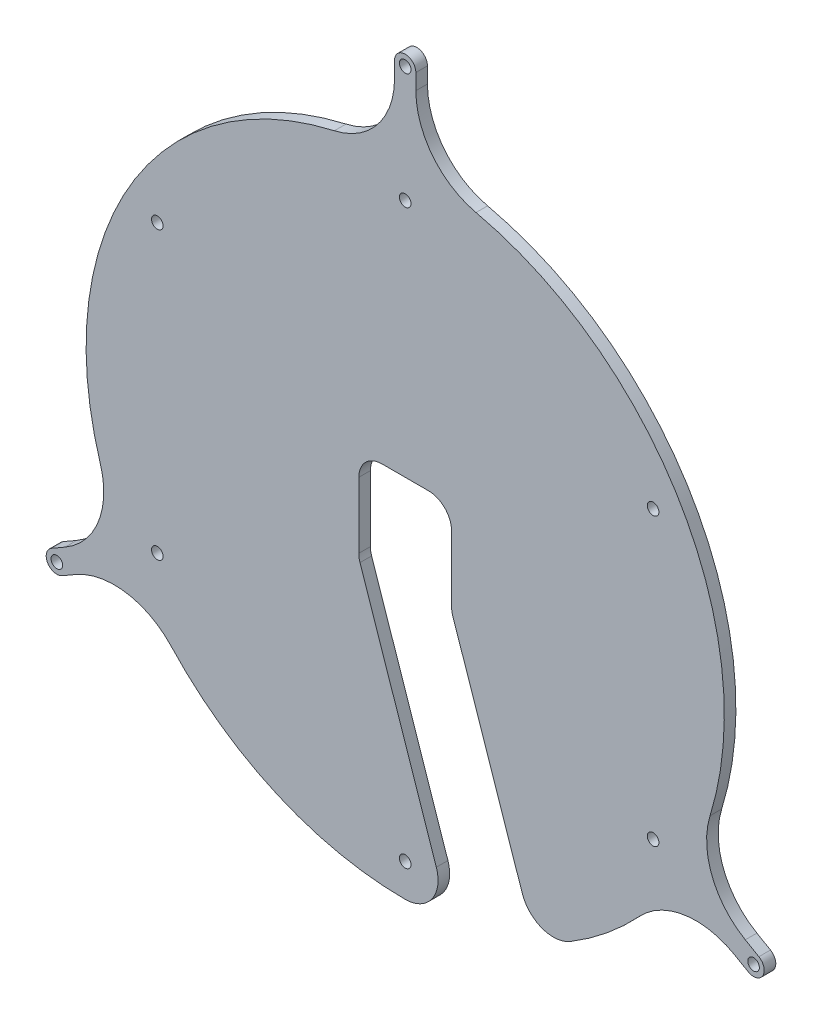
from build123d import *

# Parameters (mm, degrees)
SKETCH1_R           = 82.5
SKETCH1_R_2         = 1.5
BOSS_EXTRUDE1_DEPTH = 3
CUT_EXTRUDE1_DEPTH  = 117.711181984
FILLET1_R           = 6
BOSS_EXTRUDE2_START = -3
SKETCH3_R           = 1.5
BOSS_EXTRUDE2_DEPTH = 3
CIRPATTERN1_COUNT   = 3


with BuildPart() as part:
    # Sketch1 → Boss-Extrude1 (new body)
    with BuildSketch(Plane.XY):
        Circle(SKETCH1_R)
        with Locations((0, 74)):
            Circle(SKETCH1_R_2, mode=Mode.SUBTRACT)
        with Locations((0, -74)):
            Circle(SKETCH1_R_2, mode=Mode.SUBTRACT)
        with Locations((64.08587988, 37)):
            Circle(SKETCH1_R_2, mode=Mode.SUBTRACT)
        with Locations((64.08587988, -37)):
            Circle(SKETCH1_R_2, mode=Mode.SUBTRACT)
        with Locations((-64.08587988, -37)):
            Circle(SKETCH1_R_2, mode=Mode.SUBTRACT)
        with Locations((-64.08587988, 37)):
            Circle(SKETCH1_R_2, mode=Mode.SUBTRACT)
    extrude(amount=BOSS_EXTRUDE1_DEPTH)

    # Sketch2 → Cut-Extrude1 (cut, through all)
    with BuildSketch(Plane.XY.offset(3)):
        with BuildLine():
            Line((12, -12), (30.275351929, -66.024842017))
            ThreePointArc((30.275351929, -66.024842017), (35.411833596, -71.285530901), (42.729580876, -70.572182325))
            ThreePointArc((42.729580876, -70.572182325), (22.181579725, -79.462113746), (0, -82.5))
            ThreePointArc((0, -82.5), (6.906581307, -78.954708332), (8.051787281, -71.276266978))
            Line((8.051787281, -71.276266978), (-12, -12))
            Line((-12, -12), (-12, 12))
            Line((-12, 12), (12, 12))
            Line((12, 12), (12, -12))
        make_face()
    extrude(amount=-CUT_EXTRUDE1_DEPTH, mode=Mode.SUBTRACT)

    # Fillet1
    fillet1_edges = [part.edges().sort_by_distance(p)[0] for p in [
        (12, 12, 1.5),
        (12, -12, 1.5),
        (-12, -12, 1.5),
        (-12, 12, 1.5),
    ]]
    fillet(fillet1_edges, radius=FILLET1_R)

    # Sketch3 → Boss-Extrude2 (add)
    with BuildSketch(Plane.XY.offset(3).offset(BOSS_EXTRUDE2_START)):
        with BuildLine():
            Line((2.75, 104), (2.75, 99.943421494))
            ThreePointArc((2.75, 99.943421494), (7.117014236, 87.469057539), (18.31097561, 80.442266081))
            ThreePointArc((18.31097561, 80.442266081), (0, 82.5), (-18.31097561, 80.442266081))
            ThreePointArc((-18.31097561, 80.442266081), (-7.117014236, 87.469057539), (-2.75, 99.943421494))
            Line((-2.75, 99.943421494), (-2.75, 104))
            ThreePointArc((-2.75, 104), (0, 106.75), (2.75, 104))
        make_face()
        with Locations((0, 104)):
            Circle(SKETCH3_R, mode=Mode.SUBTRACT)
    boss_extrude2 = extrude(amount=BOSS_EXTRUDE2_DEPTH)

    # CirPattern1: Boss-Extrude2 ×3 about axis
    cirpattern1_axis = Axis((0, 0, 0), (0, 0, 1))
    for i in range(1, CIRPATTERN1_COUNT):
        add(boss_extrude2.rotate(cirpattern1_axis, i * 360 / CIRPATTERN1_COUNT))


solid = part.part
